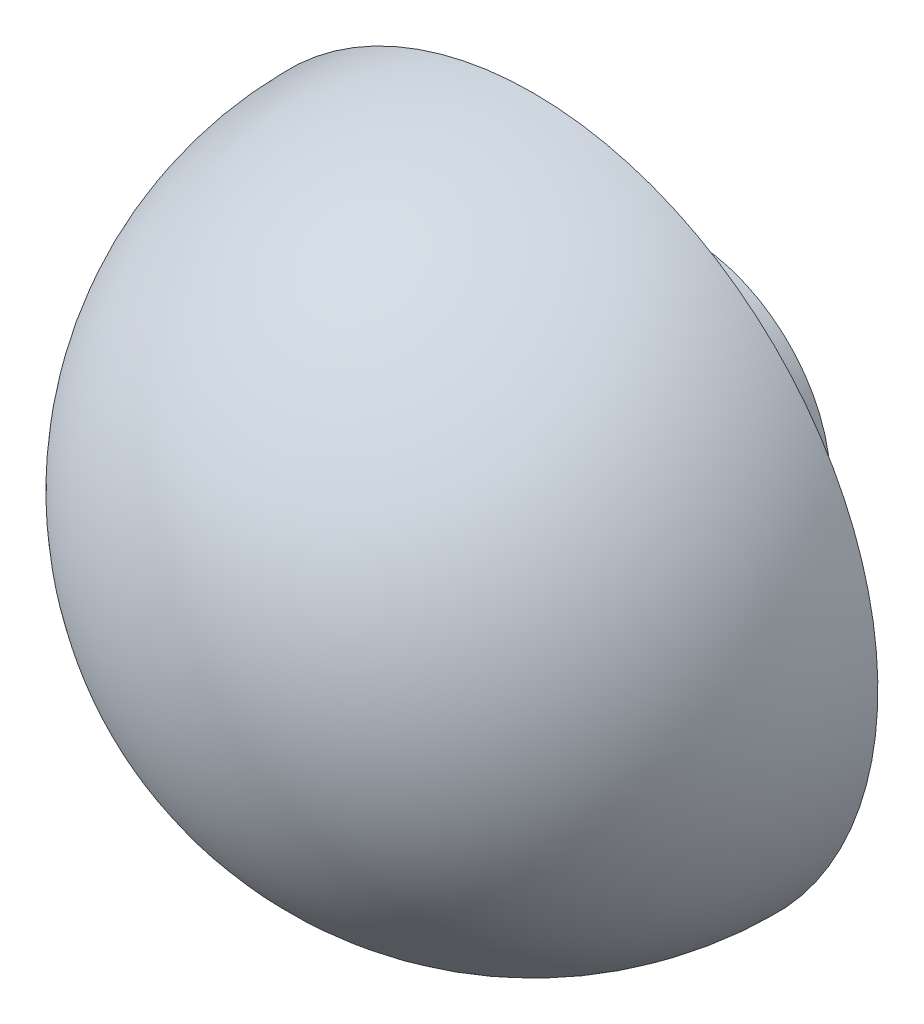
from build123d import *


with BuildPart() as part:
    # Croquis2 → Revolución1 (revolve)
    with BuildSketch(Plane(origin=(0, 0, 0), x_dir=(0, 0, -1), z_dir=(1, 0, 0))):
        with BuildLine():
            Line((0, 4), (0, 1.65))
            Line((0, 1.65), (1.8, 1.65))
            Line((1.8, 1.65), (1.8, 0))
            Line((1.8, 0), (-4, 0))
            ThreePointArc((-4, 0), (-2.828427125, 2.828427125), (0, 4))
        make_face()
    revolve(axis=Axis((0, 0, -30), (0, 0, 1)))


solid = part.part
